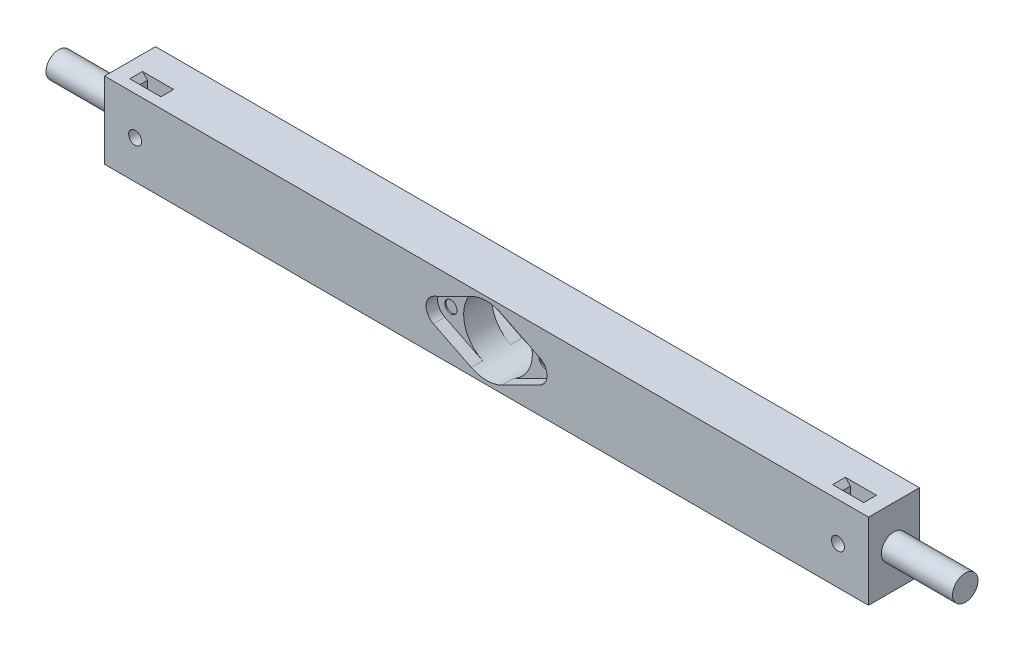
from build123d import *

# Parameters (mm, degrees)
SKETCH_1_W                 = 300
SKETCH_1_H                 = 30
EXTRUDE_1_DEPTH            = 20
SKETCH_3_R                 = 4
CUT_EXTRUDE_1_DEPTH        = 155.272486205
SKETCH_3_3_R               = 6
SKETCH_3_3_R_2             = 4
CUT_EXTRUDE_2_DEPTH        = 155.272486205
SKETCH_3_4_R               = 13.5
SKETCH_3_4_R_2             = 6
CUT_EXTRUDE_3_DEPTH        = 155.272486205
SKETCH_3_5_R               = 2.4
CUT_EXTRUDE_4_DEPTH        = 4.5
SKETCH_3_6_R               = 2.4
CUT_EXTRUDE_5_DEPTH        = 5
SKETCH_4_R                 = 5
EXTRUDE_2_DEPTH            = 28
SKETCH_5_R                 = 2.55
CUT_EXTRUDE_6_DEPTH        = 4
SKETCH_6_W                 = 8.216991224
SKETCH_6_H                 = 30
CUT_EXTRUDE_7_DEPTH        = 5
CHAMFER_1_SIZE             = 2
CHAMFER_1_OF_MIRROR_2_SIZE = 2


with BuildPart() as part:
    # 草图1 → 凸台-拉伸1 (new body)
    with BuildSketch(Plane.XY):
        with Locations((0, 15)):
            Rectangle(SKETCH_1_W, SKETCH_1_H)
    extrude(amount=EXTRUDE_1_DEPTH)

    # 草图3 → 切除-拉伸1 (cut, through all)
    with BuildSketch(Plane(origin=(0, 0, 0), x_dir=(-1, 0, 0), z_dir=(0, 0, -1))):
        with Locations((0, 15)):
            Circle(SKETCH_3_R)
    extrude(amount=-CUT_EXTRUDE_1_DEPTH, mode=Mode.SUBTRACT)

    # 草图3<3> → 切除-拉伸2 (cut, through all)
    with BuildSketch(Plane(origin=(0, 0, 0), x_dir=(-1, 0, 0), z_dir=(0, 0, -1))):
        with Locations((0, 15)):
            Circle(SKETCH_3_3_R)
        with Locations((0, 15)):
            Circle(SKETCH_3_3_R_2, mode=Mode.SUBTRACT)
    extrude(amount=-CUT_EXTRUDE_2_DEPTH, mode=Mode.SUBTRACT)

    # 草图3<4> → 切除-拉伸3 (cut, through all)
    with BuildSketch(Plane(origin=(0, 0, 0), x_dir=(-1, 0, 0), z_dir=(0, 0, -1))):
        with Locations((0, 15)):
            Circle(SKETCH_3_4_R)
        with Locations((0, 15)):
            Circle(SKETCH_3_4_R_2, mode=Mode.SUBTRACT)
    extrude(amount=-CUT_EXTRUDE_3_DEPTH, mode=Mode.SUBTRACT)

    # 草图3<5> → 切除-拉伸4 (cut)
    # profile 1 of 2: a face of its own
    with BuildSketch(Plane(origin=(0, 0, 0), x_dir=(-1, 0, 0), z_dir=(0, 0, -1))):
        with BuildLine():
            ThreePointArc((-6.02027027, 2.916691435), (-13.5, 15), (-6.02027027, 27.083308565))
            Line((-6.02027027, 27.083308565), (-20.841216216, 19.699064442))
            ThreePointArc((-20.841216216, 19.699064442), (-23.75, 15), (-20.841216216, 10.300935558))
            Line((-20.841216216, 10.300935558), (-6.02027027, 2.916691435))
        make_face()
        with Locations((-18.5, 15)):
            Circle(SKETCH_3_5_R, mode=Mode.SUBTRACT)
    # profile 2 of 2: a face of its own
    with BuildSketch(Plane(origin=(0, 0, 0), x_dir=(-1, 0, 0), z_dir=(0, 0, -1))):
        with BuildLine():
            Line((20.841216216, 19.699064442), (6.02027027, 27.083308565))
            ThreePointArc((6.02027027, 27.083308565), (13.5, 15), (6.02027027, 2.916691435))
            Line((6.02027027, 2.916691435), (20.841216216, 10.300935558))
            ThreePointArc((20.841216216, 10.300935558), (23.75, 15), (20.841216216, 19.699064442))
        make_face()
        with Locations((18.5, 15)):
            Circle(SKETCH_3_5_R, mode=Mode.SUBTRACT)
    cut_extrude_4 = extrude(amount=-CUT_EXTRUDE_4_DEPTH, mode=Mode.SUBTRACT)

    # 草图3<6> → 切除-拉伸5 (cut)
    with BuildSketch(Plane(origin=(0, 0, 0), x_dir=(-1, 0, 0), z_dir=(0, 0, -1))):
        with Locations((18.5, 15)):
            Circle(SKETCH_3_6_R)
        with Locations((-18.5, 15)):
            Circle(SKETCH_3_6_R)
    cut_extrude_5 = extrude(amount=-CUT_EXTRUDE_5_DEPTH, mode=Mode.SUBTRACT)

    # 草图4 → 凸台-拉伸2 (add)
    with BuildSketch(Plane.ZY.offset(150)):
        with Locations((10, 15)):
            Circle(SKETCH_4_R)
    extrude_2 = extrude(amount=EXTRUDE_2_DEPTH)

    # 镜向1: 凸台-拉伸2 across plane
    add(extrude_2.mirror(Plane.ZY))

    # 草图5 → 切除-拉伸6 (cut)
    with BuildSketch(Plane.XY.offset(20)):
        with Locations((-138, 15)):
            Circle(SKETCH_5_R)
    cut_extrude_6 = extrude(amount=-CUT_EXTRUDE_6_DEPTH, mode=Mode.SUBTRACT)

    # 草图6 → 切除-拉伸7 (cut)
    with BuildSketch(Plane.XY.offset(16)):
        with Locations((-138, 15)):
            Rectangle(SKETCH_6_W, SKETCH_6_H)
    cut_extrude_7 = extrude(amount=-CUT_EXTRUDE_7_DEPTH, mode=Mode.SUBTRACT)

    # 倒角1
    chamfer_1_edges = [part.edges().sort_by_distance(p)[0] for p in [
        (-133.891504388, 0, 13.5),
        (-142.108495612, 0, 13.5),
        (-133.891504388, 30, 13.5),
        (-142.108495612, 30, 13.5),
    ]]
    chamfer(chamfer_1_edges, length=CHAMFER_1_SIZE)

    # 镜向2: 切除-拉伸6, 切除-拉伸7 across plane
    add(cut_extrude_6.mirror(Plane.ZY), mode=Mode.SUBTRACT)
    add(cut_extrude_7.mirror(Plane.ZY), mode=Mode.SUBTRACT)

    # 倒角1 of 镜向2
    chamfer_1_of_mirror_2_edges = [part.edges().sort_by_distance(p)[0] for p in [
        (133.891504388, 0, 13.5),
        (142.108495612, 0, 13.5),
        (133.891504388, 30, 13.5),
        (142.108495612, 30, 13.5),
    ]]
    chamfer(chamfer_1_of_mirror_2_edges, length=CHAMFER_1_OF_MIRROR_2_SIZE)

    # 镜向3: 切除-拉伸4, 切除-拉伸5 across plane
    add(cut_extrude_4.mirror(Plane.XY.offset(10)), mode=Mode.SUBTRACT)
    add(cut_extrude_5.mirror(Plane.XY.offset(10)), mode=Mode.SUBTRACT)


solid = part.part
